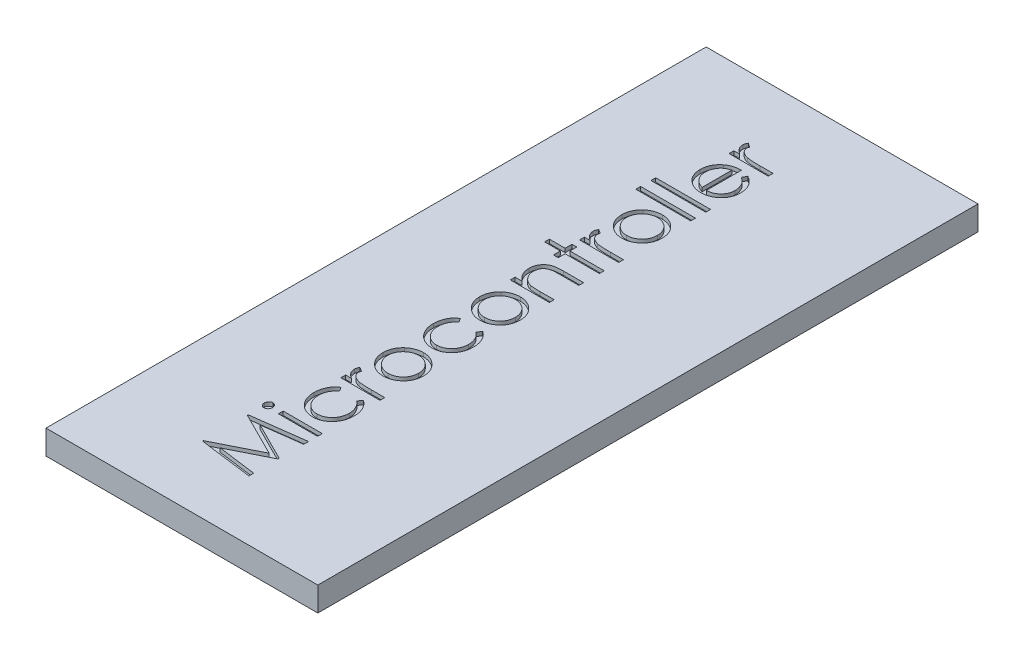
from build123d import *

# Parameters (mm, degrees)
SKETCH1_W           = 17.78
SKETCH1_H           = 43.18
BOSS_EXTRUDE1_DEPTH = 1.5875
SKETCH2_W           = 2.557692308
SKETCH2_H           = 0.314102564
SKETCH2_W_2         = 3.58974359
CUT_EXTRUDE1_DEPTH  = 0.254


with BuildPart() as part:
    # Sketch1 → Boss-Extrude1 (new body)
    with BuildSketch(Plane(origin=(0, 0, 0), x_dir=(1, 0, 0), z_dir=(0, 1, 0))):
        Rectangle(SKETCH1_W, SKETCH1_H)
    extrude(amount=BOSS_EXTRUDE1_DEPTH)

    # Sketch2 → Cut-Extrude1 (cut)
    # profile 1 of 16: a face of its own
    with BuildSketch(Plane(origin=(0, 1.5875, 0), x_dir=(1, 0, 0), z_dir=(0, 1, 0))):
        Polygon((0.45690123, -17.66715988), (-3.04309877, -17.205120617), (-3.04309877, -17.160248822), (-0.171303899, -15.715236803), (-3.04309877, -14.273730393), (-3.04309877, -14.228157476), (0.45690123, -13.763313726), (0.45690123, -14.078818534), (-2.061528258, -14.413954752), (0.45690123, -15.677376226), (0.45690123, -15.748189528), (-2.067137232, -17.016518854), (0.45690123, -17.350953951), align=None)
    # profile 2 of 16: a face of its own
    with BuildSketch(Plane(origin=(0, 1.5875, 0), x_dir=(1, 0, 0), z_dir=(0, 1, 0))):
        with BuildLine():
            add(Edge.make_bspline(
                [(-3.177714155, -13.024331354), (-3.176810003, -13.004840039), (-3.175039499, -12.966672299), (-3.159878022, -12.911479031), (-3.134178336, -12.861222019), (-3.099698655, -12.816644286), (-3.059149212, -12.778392399), (-3.011888243, -12.751611689), (-2.960829605, -12.734399293), (-2.925214515, -12.732320738), (-2.907081142, -12.731262444)],
                knots=[0, 0, 0, 0, 1.055194115, 2.066272739, 3.074728998, 4.095836921, 5.109056067, 6.073838105, 7.019297344, 8, 8, 8, 8], degree=3))
            add(Edge.make_bspline(
                [(-2.907081142, -12.731262444), (-2.889418489, -12.732344604), (-2.854501514, -12.734483906), (-2.804328042, -12.751598394), (-2.757723759, -12.778620632), (-2.717253048, -12.816619758), (-2.682792428, -12.861228519), (-2.657087689, -12.911477304), (-2.641927552, -12.966672753), (-2.640156863, -13.004840192), (-2.639252617, -13.024331354)],
                knots=[0, 0, 0, 0, 0.96129708, 1.900370562, 2.859976407, 3.87933698, 4.906634145, 5.921202961, 6.938410037, 8, 8, 8, 8], degree=3))
            add(Edge.make_bspline(
                [(-2.639252617, -13.024331354), (-2.640122337, -13.04359963), (-2.641815134, -13.08110281), (-2.657385151, -13.135469652), (-2.682801224, -13.185298142), (-2.71702741, -13.229962814), (-2.757972307, -13.267193007), (-2.804299601, -13.294291333), (-2.854508755, -13.311366295), (-2.889420922, -13.313510923), (-2.907081142, -13.314595778)],
                knots=[0, 0, 0, 0, 1.054934014, 2.053291228, 3.073705704, 4.106921865, 5.123545215, 6.088680038, 7.033164197, 8, 8, 8, 8], degree=3))
            add(Edge.make_bspline(
                [(-2.907081142, -13.314595778), (-2.925211992, -13.313534691), (-2.960822124, -13.31145065), (-3.011917157, -13.294278534), (-3.058898659, -13.267418726), (-3.099924159, -13.229938162), (-3.134169593, -13.185304702), (-3.159580575, -13.135467957), (-3.175151914, -13.081103258), (-3.176844529, -13.043599782), (-3.177714155, -13.024331354)],
                knots=[0, 0, 0, 0, 0.98631895, 1.937192651, 2.907499808, 3.917963147, 4.944918757, 5.95915025, 6.951458133, 8, 8, 8, 8], degree=3))
        make_face()
    # profile 3 of 16: a face of its own
    with BuildSketch(Plane(origin=(0, 1.5875, 0), x_dir=(1, 0, 0), z_dir=(0, 1, 0))):
        with Locations((-0.821944924, -13.022929111)):
            Rectangle(SKETCH2_W, SKETCH2_H)
    # profile 4 of 16: a face of its own
    with BuildSketch(Plane(origin=(0, 1.5875, 0), x_dir=(1, 0, 0), z_dir=(0, 1, 0))):
        with BuildLine():
            Line((-1.546203738, -9.635108598), (-1.38284236, -9.898029271))
            add(Edge.make_bspline(
                [(-1.38284236, -9.898029271), (-1.418670754, -9.926859136), (-1.489192864, -9.983605832), (-1.580202798, -10.082145068), (-1.658369839, -10.187156482), (-1.72207359, -10.30043453), (-1.771295041, -10.42182033), (-1.806125246, -10.550835181), (-1.827829489, -10.687460686), (-1.830296326, -10.781125885), (-1.831560309, -10.829119015)],
                knots=[0, 0, 0, 0, 1.026593902, 2.0206758, 2.988051866, 3.946915611, 4.916868779, 5.907761954, 6.927957743, 8, 8, 8, 8], degree=3))
            add(Edge.make_bspline(
                [(-1.831560309, -10.829119015), (-1.830503467, -10.867477972), (-1.828422045, -10.943024894), (-1.815411551, -11.053931048), (-1.791769543, -11.159573401), (-1.760618586, -11.26061411), (-1.718868296, -11.356334528), (-1.66805854, -11.446985447), (-1.6090085, -11.533370937), (-1.540597955, -11.612987678), (-1.466199287, -11.685816685), (-1.386445592, -11.748915599), (-1.3037257, -11.803852532), (-1.215973958, -11.846958489), (-1.125197905, -11.882233659), (-1.029684049, -11.905440379), (-0.930656042, -11.920905075), (-0.863137702, -11.922674403), (-0.828956142, -11.923570136)],
                knots=[0, 0, 0, 0, 1.112346261, 2.190735716, 3.231507886, 4.247384806, 5.251966152, 6.253067467, 7.256802811, 8.280671706, 9.291813951, 10.270744147, 11.225547591, 12.165006084, 13.100104208, 14.043489273, 15.009504848, 16, 16, 16, 16], degree=3))
            add(Edge.make_bspline(
                [(-0.828956142, -11.923570136), (-0.784193329, -11.921763918), (-0.695041781, -11.918166576), (-0.563666016, -11.890806002), (-0.436881641, -11.845024554), (-0.315374074, -11.78317594), (-0.2027897, -11.704669325), (-0.101803653, -11.612504577), (-0.014388318, -11.506583404), (0.058084398, -11.387851649), (0.116345713, -11.259093747), (0.15785306, -11.121703685), (0.182905429, -10.976803893), (0.186061373, -10.877597148), (0.18767046, -10.827015649)],
                knots=[0, 0, 0, 0, 0.96628757, 1.924499989, 2.884001032, 3.87047137, 4.860396324, 5.839257425, 6.814467993, 7.816059692, 8.834901047, 9.858382822, 10.908076205, 12, 12, 12, 12], degree=3))
            add(Edge.make_bspline(
                [(0.18767046, -10.827015649), (0.186370963, -10.780660465), (0.183817106, -10.689560227), (0.162288143, -10.556392941), (0.127044509, -10.429613031), (0.077896859, -10.309225), (0.014369343, -10.195448834), (-0.063989827, -10.089019659), (-0.154926428, -9.987819721), (-0.225244399, -9.928322744), (-0.261047488, -9.898029271)],
                knots=[0, 0, 0, 0, 1.039848629, 2.043578496, 3.018386758, 3.987534228, 4.954977003, 5.934852016, 6.948509513, 8, 8, 8, 8], degree=3))
            Line((-0.261047488, -9.898029271), (-0.088571527, -9.635108598))
            add(Edge.make_bspline(
                [(-0.088571527, -9.635108598), (-0.0656808, -9.6506963), (-0.019975323, -9.681819967), (0.044468793, -9.733847593), (0.104790476, -9.789967424), (0.160908866, -9.849960521), (0.214166885, -9.913043531), (0.26201846, -9.981371441), (0.307153282, -10.052741052), (0.347766154, -10.12799021), (0.384272476, -10.206340908), (0.415663647, -10.287682897), (0.442633753, -10.37166271), (0.464071099, -10.458379086), (0.481181938, -10.548002985), (0.492535639, -10.640302619), (0.501010921, -10.735246201), (0.501516787, -10.799418352), (0.501773024, -10.831923502)],
                knots=[0, 0, 0, 0, 0.954134338, 1.905101784, 2.851144739, 3.791306361, 4.734911809, 5.6936923, 6.663572882, 7.643865596, 8.638447847, 9.640600242, 10.646758161, 11.676244097, 12.717260333, 13.78922464, 14.880174919, 16, 16, 16, 16], degree=3))
            add(Edge.make_bspline(
                [(0.501773024, -10.831923502), (0.500880264, -10.881533737), (0.499130447, -10.978770157), (0.479942862, -11.121101821), (0.450909386, -11.257082238), (0.409591883, -11.386950373), (0.355027378, -11.509912262), (0.289902697, -11.626991567), (0.212065657, -11.736980107), (0.123365407, -11.839156833), (0.027095649, -11.932597415), (-0.076187344, -12.013905418), (-0.184201317, -12.08281141), (-0.297627109, -12.139573914), (-0.415999621, -12.183956896), (-0.540041999, -12.214512999), (-0.668701808, -12.234228834), (-0.756433652, -12.236514123), (-0.80091127, -12.237672701)],
                knots=[0, 0, 0, 0, 1.113096611, 2.181677437, 3.217994567, 4.231807234, 5.234933164, 6.233258928, 7.234764453, 8.254006763, 9.267004511, 10.242118657, 11.199842941, 12.138404996, 13.084707599, 14.031460992, 15.002005182, 16, 16, 16, 16], degree=3))
            add(Edge.make_bspline(
                [(-0.80091127, -12.237672701), (-0.831089705, -12.237231684), (-0.891119592, -12.236354431), (-0.980214659, -12.226292503), (-1.068123204, -12.21329403), (-1.153730924, -12.191268293), (-1.238336214, -12.165827661), (-1.320919315, -12.133352129), (-1.401863988, -12.095256734), (-1.480961717, -12.052004787), (-1.556911257, -12.003316042), (-1.628664922, -11.949434809), (-1.697084687, -11.892390473), (-1.759808448, -11.829514361), (-1.819344639, -11.763474707), (-1.874102763, -11.692403131), (-1.924243754, -11.616707279), (-1.97069477, -11.537523957), (-2.012054205, -11.454899245), (-2.047687443, -11.369332575), (-2.078140019, -11.281339546), (-2.102248938, -11.190779402), (-2.122466361, -11.098253229), (-2.135184208, -11.003031891), (-2.14417048, -10.905479668), (-2.145161273, -10.839423646), (-2.145662873, -10.805981995)],
                knots=[0, 0, 0, 0, 0.990994727, 1.971252077, 2.943264845, 3.907940874, 4.872158414, 5.844625996, 6.82015047, 7.809835459, 8.804511986, 9.781214284, 10.756496977, 11.728388426, 12.696359165, 13.676225489, 14.672885716, 15.677705647, 16.690706858, 17.706033469, 18.721040654, 19.747369689, 20.783475414, 21.830280724, 22.901553713, 24, 24, 24, 24], degree=3))
            add(Edge.make_bspline(
                [(-2.145662873, -10.805981995), (-2.144741077, -10.764101835), (-2.142902094, -10.680550852), (-2.127422024, -10.556610918), (-2.104090939, -10.434492817), (-2.069498322, -10.316356505), (-2.027705785, -10.203571202), (-1.980492031, -10.098275654), (-1.92682662, -10.002060032), (-1.867038109, -9.914075662), (-1.798929452, -9.834346921), (-1.723193909, -9.760830339), (-1.639286333, -9.693041543), (-1.577487338, -9.654578952), (-1.546203738, -9.635108598)],
                knots=[0, 0, 0, 0, 1.095139042, 2.184804066, 3.262657822, 4.34424993, 5.400369085, 6.407210964, 7.359649996, 8.278719237, 9.185177137, 10.097389079, 11.036869154, 12, 12, 12, 12], degree=3))
        make_face()
    # profile 5 of 16: a face of its own
    with BuildSketch(Plane(origin=(0, 1.5875, 0), x_dir=(1, 0, 0), z_dir=(0, 1, 0))):
        with BuildLine():
            Line((-2.100791078, -9.09664706), (-2.100791078, -8.782544495))
            Line((-2.100791078, -8.782544495), (-1.724288674, -8.782544495))
            add(Edge.make_bspline(
                [(-1.724288674, -8.782544495), (-1.759360196, -8.759370574), (-1.82643421, -8.715050629), (-1.915024828, -8.641040811), (-1.989211982, -8.566041237), (-2.047580911, -8.488082556), (-2.091693568, -8.40792909), (-2.122690151, -8.326256734), (-2.141912074, -8.242865767), (-2.144410932, -8.186690305), (-2.145662873, -8.158546098)],
                knots=[0, 0, 0, 0, 1.280091057, 2.448164201, 3.510831157, 4.48793739, 5.405868014, 6.289422536, 7.142991551, 8, 8, 8, 8], degree=3))
            add(Edge.make_bspline(
                [(-2.145662873, -8.158546098), (-2.144472346, -8.136719772), (-2.142022761, -8.091810686), (-2.124811936, -8.023828097), (-2.097333913, -7.953784645), (-2.071493691, -7.908642257), (-2.058022649, -7.885108598)],
                knots=[0, 0, 0, 0, 0.901110191, 1.854092781, 2.881294221, 4, 4, 4, 4], degree=3))
            Line((-2.058022649, -7.885108598), (-1.785987392, -8.05758456))
            add(Edge.make_bspline(
                [(-1.785987392, -8.05758456), (-1.792727658, -8.072693581), (-1.805521974, -8.101373395), (-1.820663984, -8.143327962), (-1.8295799, -8.182009298), (-1.830930617, -8.206652857), (-1.831560309, -8.218141451)],
                knots=[0, 0, 0, 0, 1.180555205, 2.24091978, 3.179933427, 4, 4, 4, 4], degree=3))
            add(Edge.make_bspline(
                [(-1.831560309, -8.218141451), (-1.829893428, -8.243354752), (-1.826493475, -8.294782577), (-1.79938281, -8.370033911), (-1.756839991, -8.443709286), (-1.708396299, -8.50165752), (-1.661861896, -8.546684384), (-1.621134031, -8.579066563), (-1.575043227, -8.60813005), (-1.525370995, -8.636322404), (-1.470870703, -8.66251523), (-1.411453441, -8.685922367), (-1.347609855, -8.707812547), (-1.303217921, -8.720140087), (-1.280478578, -8.726454752)],
                knots=[0, 0, 0, 0, 1.125322384, 2.295331465, 3.535939348, 4.916963136, 5.656144286, 6.429838446, 7.238666481, 8.090384391, 8.983239461, 9.940052224, 10.944811494, 12, 12, 12, 12], degree=3))
            add(Edge.make_bspline(
                [(-1.280478578, -8.726454752), (-1.260202527, -8.731195324), (-1.215067404, -8.741747985), (-1.139690004, -8.751734378), (-1.050691377, -8.761998762), (-0.947968133, -8.769008302), (-0.831125402, -8.775629748), (-0.700667242, -8.779287708), (-0.556235089, -8.782428112), (-0.455494229, -8.782504463), (-0.402674091, -8.782544495)],
                knots=[0, 0, 0, 0, 0.566841273, 1.261806378, 2.068780918, 3.007109044, 4.065315289, 5.256255371, 6.561408263, 8, 8, 8, 8], degree=3))
            Line((-0.402674091, -8.782544495), (0.45690123, -8.782544495))
            Line((0.45690123, -8.782544495), (0.45690123, -9.09664706))
            Line((0.45690123, -9.09664706), (-2.100791078, -9.09664706))
        make_face()
    # profile 6 of 16: a face of its own
    with BuildSketch(Plane(origin=(0, 1.5875, 0), x_dir=(1, 0, 0), z_dir=(0, 1, 0))):
        with BuildLine():
            add(Edge.make_bspline(
                [(-2.145662873, -6.290757636), (-2.144640982, -6.242766364), (-2.142637303, -6.148667206), (-2.121222337, -6.01085932), (-2.088474973, -5.879314184), (-2.043203411, -5.753527992), (-1.98252146, -5.635111697), (-1.910112169, -5.522340453), (-1.824329576, -5.415523444), (-1.757971507, -5.351500414), (-1.724288674, -5.319002829)],
                knots=[0, 0, 0, 0, 1.054011418, 2.066658804, 3.057071809, 4.030435133, 4.997543892, 5.974964718, 6.972108034, 8, 8, 8, 8], degree=3))
            add(Edge.make_bspline(
                [(-1.724288674, -5.319002829), (-1.692074689, -5.291020875), (-1.628270146, -5.235598494), (-1.524814533, -5.164532776), (-1.417674433, -5.103311216), (-1.305427106, -5.054248255), (-1.189052435, -5.015563231), (-1.068150424, -4.988097535), (-0.942988077, -4.9717606), (-0.857984239, -4.969557633), (-0.814933706, -4.968441931)],
                knots=[0, 0, 0, 0, 1.025258237, 2.030674902, 3.01204498, 3.988269485, 4.97094183, 5.956517959, 6.965070386, 8, 8, 8, 8], degree=3))
            add(Edge.make_bspline(
                [(-0.814933706, -4.968441931), (-0.771633649, -4.969423269), (-0.686070715, -4.971362437), (-0.56005135, -4.989706053), (-0.437856527, -5.018237139), (-0.319997833, -5.059068977), (-0.206115006, -5.111427087), (-0.096705456, -5.175317774), (0.008446677, -5.251189391), (0.108448515, -5.337193388), (0.20061473, -5.432245264), (0.280942999, -5.535361413), (0.349764524, -5.644515446), (0.405200939, -5.7611588), (0.44891064, -5.884226286), (0.479610656, -6.013983355), (0.49817234, -6.150228425), (0.500555913, -6.243255646), (0.501773024, -6.290757636)],
                knots=[0, 0, 0, 0, 0.998656419, 1.973391657, 2.932242238, 3.890759089, 4.846373663, 5.82037756, 6.809684879, 7.83454468, 8.860553229, 9.859544525, 10.845671541, 11.83227036, 12.833544569, 13.85385346, 14.904124723, 16, 16, 16, 16], degree=3))
            add(Edge.make_bspline(
                [(0.501773024, -6.290757636), (0.500551828, -6.338492356), (0.498160054, -6.431983216), (0.479682771, -6.568709198), (0.448924788, -6.698698817), (0.405057296, -6.821927415), (0.349762752, -6.939072262), (0.281151062, -7.048858759), (0.200590907, -7.152058675), (0.10845497, -7.247130659), (0.008445014, -7.333129264), (-0.096705025, -7.409002273), (-0.206115118, -7.472892599), (-0.319997803, -7.525250803), (-0.437856535, -7.566082616), (-0.560051347, -7.594613708), (-0.686070716, -7.612957323), (-0.771633649, -7.614896491), (-0.814933706, -7.615877829)],
                knots=[0, 0, 0, 0, 1.099876186, 2.154163076, 3.173186993, 4.173200201, 5.163417411, 6.152872554, 7.150605724, 8.17532212, 9.198891216, 10.186952605, 11.159729845, 12.11414092, 13.071450619, 14.029093627, 15.002601286, 16, 16, 16, 16], degree=3))
            add(Edge.make_bspline(
                [(-0.814933706, -7.615877829), (-0.857751208, -7.614757187), (-0.942522501, -7.612538509), (-1.067435701, -7.59617928), (-1.187967682, -7.569012431), (-1.303706854, -7.529791122), (-1.415684397, -7.480819238), (-1.523217331, -7.420213846), (-1.626220886, -7.348460685), (-1.689940816, -7.29325362), (-1.722185309, -7.265316931)],
                knots=[0, 0, 0, 0, 1.031377469, 2.041950136, 3.029500481, 4.003457997, 4.981637986, 5.969878303, 6.97268806, 8, 8, 8, 8], degree=3))
            add(Edge.make_bspline(
                [(-1.722185309, -7.265316931), (-1.756160248, -7.23286834), (-1.822977944, -7.169052476), (-1.908510468, -7.061703749), (-1.982426542, -6.949209928), (-2.041902758, -6.829485002), (-2.088741275, -6.703802144), (-2.121306791, -6.571582901), (-2.142560146, -6.433307386), (-2.144618323, -6.338747764), (-2.145662873, -6.290757636)],
                knots=[0, 0, 0, 0, 1.027980169, 2.021703884, 2.998553061, 3.971491411, 4.943284454, 5.930300938, 6.949603206, 8, 8, 8, 8], degree=3))
        make_face()
        with BuildLine():
            add(Edge.make_bspline(
                [(-1.831560309, -6.29215988), (-1.830595717, -6.326097491), (-1.828691435, -6.39309662), (-1.81420753, -6.491716204), (-1.791260027, -6.586656362), (-1.758655965, -6.678097192), (-1.71655709, -6.765730417), (-1.664848639, -6.849639619), (-1.604216033, -6.930072834), (-1.534752001, -7.005451895), (-1.458878057, -7.074645348), (-1.378011455, -7.135083085), (-1.293390902, -7.18676386), (-1.20488906, -7.229035665), (-1.112204172, -7.261455138), (-1.01588206, -7.284428192), (-0.915631866, -7.298938619), (-0.847468755, -7.300819472), (-0.812830341, -7.301775265)],
                knots=[0, 0, 0, 0, 1.02155314, 2.01673505, 2.994700672, 3.958461264, 4.934171024, 5.916582427, 6.921469794, 7.962398674, 8.998583302, 10.009097305, 10.997513862, 11.97957236, 12.956600784, 13.948243505, 14.957359924, 16, 16, 16, 16], degree=3))
            add(Edge.make_bspline(
                [(-0.812830341, -7.301775265), (-0.768078314, -7.300168441), (-0.679253908, -7.296979197), (-0.548442786, -7.27104396), (-0.422860934, -7.22765768), (-0.303244547, -7.169070401), (-0.192572269, -7.095664182), (-0.093900785, -7.009177115), (-0.008714974, -6.910537415), (0.061965872, -6.800920915), (0.118125628, -6.682566597), (0.157924603, -6.557310276), (0.183796296, -6.426669582), (0.18636777, -6.33738885), (0.18767046, -6.29215988)],
                knots=[0, 0, 0, 0, 1.016792936, 2.018143844, 3.017858371, 4.030088057, 5.03801393, 6.028138512, 7.003788237, 7.991172063, 8.984598303, 9.972568034, 10.972917682, 12, 12, 12, 12], degree=3))
            add(Edge.make_bspline(
                [(0.18767046, -6.29215988), (0.18636018, -6.246933511), (0.183773723, -6.157657915), (0.158054903, -6.027198738), (0.117951243, -5.902284766), (0.062029033, -5.784053379), (-0.008983382, -5.674486776), (-0.093419759, -5.575137654), (-0.19283361, -5.489389043), (-0.303391139, -5.416055438), (-0.422675491, -5.356508695), (-0.548465964, -5.313325494), (-0.679248005, -5.287327908), (-0.768076336, -5.284147079), (-0.812830341, -5.282544495)],
                knots=[0, 0, 0, 0, 1.02726834, 2.027799167, 3.010890988, 4.004497153, 4.992059811, 5.971914811, 6.958719428, 7.966827853, 8.981595046, 9.981490638, 10.983022906, 12, 12, 12, 12], degree=3))
            add(Edge.make_bspline(
                [(-0.812830341, -5.282544495), (-0.847468962, -5.283499958), (-0.91563248, -5.285380163), (-1.015879713, -5.299895308), (-1.112212758, -5.322850937), (-1.204857442, -5.355334491), (-1.29362052, -5.397418528), (-1.377763406, -5.450092805), (-1.459158119, -5.510283689), (-1.534506719, -5.580311948), (-1.60424311, -5.655612334), (-1.664872151, -5.736078143), (-1.716329836, -5.819862922), (-1.759016053, -5.907241557), (-1.7909634, -5.998694111), (-1.81434003, -6.093501244), (-1.828630227, -6.191700053), (-1.830577368, -6.258459096), (-1.831560309, -6.29215988)],
                knots=[0, 0, 0, 0, 1.042975879, 2.052417305, 3.044379404, 4.0217225, 5.00409729, 5.996508862, 7.007348322, 8.048612455, 9.089876587, 10.095087598, 11.077815406, 12.047498138, 13.018202342, 13.98964644, 14.985148868, 16, 16, 16, 16], degree=3))
        make_face(mode=Mode.SUBTRACT)
    # profile 7 of 16: a face of its own
    with BuildSketch(Plane(origin=(0, 1.5875, 0), x_dir=(1, 0, 0), z_dir=(0, 1, 0))):
        with BuildLine():
            Line((-1.546203738, -1.82741629), (-1.38284236, -2.090336963))
            add(Edge.make_bspline(
                [(-1.38284236, -2.090336963), (-1.418670754, -2.119166829), (-1.489192864, -2.175913524), (-1.580202798, -2.27445276), (-1.658369839, -2.379464175), (-1.72207359, -2.492742222), (-1.771295041, -2.614128022), (-1.806125246, -2.743142874), (-1.827829489, -2.879768379), (-1.830296326, -2.973433578), (-1.831560309, -3.021426707)],
                knots=[0, 0, 0, 0, 1.026593902, 2.0206758, 2.988051866, 3.946915611, 4.916868779, 5.907761954, 6.927957743, 8, 8, 8, 8], degree=3))
            add(Edge.make_bspline(
                [(-1.831560309, -3.021426707), (-1.830503467, -3.059785664), (-1.828422045, -3.135332587), (-1.815411551, -3.24623874), (-1.791769543, -3.351881093), (-1.760618586, -3.452921802), (-1.718868296, -3.548642221), (-1.66805854, -3.639293139), (-1.6090085, -3.725678629), (-1.540597955, -3.80529537), (-1.466199287, -3.878124377), (-1.386445592, -3.941223291), (-1.3037257, -3.996160225), (-1.215973958, -4.039266181), (-1.125197905, -4.074541351), (-1.029684049, -4.097748072), (-0.930656042, -4.113212767), (-0.863137702, -4.114982096), (-0.828956142, -4.115877829)],
                knots=[0, 0, 0, 0, 1.112346261, 2.190735716, 3.231507886, 4.247384806, 5.251966152, 6.253067467, 7.256802811, 8.280671706, 9.291813951, 10.270744147, 11.225547591, 12.165006084, 13.100104208, 14.043489273, 15.009504848, 16, 16, 16, 16], degree=3))
            add(Edge.make_bspline(
                [(-0.828956142, -4.115877829), (-0.784193329, -4.114071611), (-0.695041781, -4.110474268), (-0.563666016, -4.083113694), (-0.436881641, -4.037332246), (-0.315374074, -3.975483633), (-0.2027897, -3.896977018), (-0.101803653, -3.804812269), (-0.014388318, -3.698891096), (0.058084398, -3.580159341), (0.116345713, -3.451401439), (0.15785306, -3.314011378), (0.182905429, -3.169111586), (0.186061373, -3.06990484), (0.18767046, -3.019323342)],
                knots=[0, 0, 0, 0, 0.96628757, 1.924499989, 2.884001032, 3.87047137, 4.860396324, 5.839257425, 6.814467993, 7.816059692, 8.834901047, 9.858382822, 10.908076205, 12, 12, 12, 12], degree=3))
            add(Edge.make_bspline(
                [(0.18767046, -3.019323342), (0.186370963, -2.972968157), (0.183817106, -2.881867919), (0.162288143, -2.748700634), (0.127044509, -2.621920723), (0.077896859, -2.501532692), (0.014369343, -2.387756526), (-0.063989827, -2.281327351), (-0.154926428, -2.180127413), (-0.225244399, -2.120630436), (-0.261047488, -2.090336963)],
                knots=[0, 0, 0, 0, 1.039848629, 2.043578496, 3.018386758, 3.987534228, 4.954977003, 5.934852016, 6.948509513, 8, 8, 8, 8], degree=3))
            Line((-0.261047488, -2.090336963), (-0.088571527, -1.82741629))
            add(Edge.make_bspline(
                [(-0.088571527, -1.82741629), (-0.0656808, -1.843003993), (-0.019975323, -1.874127659), (0.044468793, -1.926155285), (0.104790476, -1.982275117), (0.160908866, -2.042268213), (0.214166885, -2.105351223), (0.26201846, -2.173679133), (0.307153282, -2.245048744), (0.347766154, -2.320297902), (0.384272476, -2.3986486), (0.415663647, -2.47999059), (0.442633753, -2.563970402), (0.464071099, -2.650686779), (0.481181938, -2.740310677), (0.492535639, -2.832610311), (0.501010921, -2.927553893), (0.501516787, -2.991726044), (0.501773024, -3.024231194)],
                knots=[0, 0, 0, 0, 0.954134338, 1.905101784, 2.851144739, 3.791306361, 4.734911809, 5.6936923, 6.663572882, 7.643865596, 8.638447847, 9.640600242, 10.646758161, 11.676244097, 12.717260333, 13.78922464, 14.880174919, 16, 16, 16, 16], degree=3))
            add(Edge.make_bspline(
                [(0.501773024, -3.024231194), (0.500880264, -3.073841429), (0.499130447, -3.171077849), (0.479942862, -3.313409513), (0.450909386, -3.44938993), (0.409591883, -3.579258065), (0.355027378, -3.702219955), (0.289902697, -3.819299259), (0.212065657, -3.9292878), (0.123365407, -4.031464526), (0.027095649, -4.124905108), (-0.076187344, -4.20621311), (-0.184201317, -4.275119102), (-0.297627109, -4.331881606), (-0.415999621, -4.376264588), (-0.540041999, -4.406820691), (-0.668701808, -4.426536526), (-0.756433652, -4.428821815), (-0.80091127, -4.429980393)],
                knots=[0, 0, 0, 0, 1.113096611, 2.181677437, 3.217994567, 4.231807234, 5.234933164, 6.233258928, 7.234764453, 8.254006763, 9.267004511, 10.242118657, 11.199842941, 12.138404996, 13.084707599, 14.031460992, 15.002005182, 16, 16, 16, 16], degree=3))
            add(Edge.make_bspline(
                [(-0.80091127, -4.429980393), (-0.831089705, -4.429539377), (-0.891119592, -4.428662123), (-0.980214659, -4.418600195), (-1.068123204, -4.405601722), (-1.153730924, -4.383575985), (-1.238336214, -4.358135353), (-1.320919315, -4.325659822), (-1.401863988, -4.287564427), (-1.480961717, -4.244312479), (-1.556911257, -4.195623734), (-1.628664922, -4.141742501), (-1.697084687, -4.084698165), (-1.759808448, -4.021822053), (-1.819344639, -3.955782399), (-1.874102763, -3.884710823), (-1.924243754, -3.809014972), (-1.97069477, -3.729831649), (-2.012054205, -3.647206938), (-2.047687443, -3.561640267), (-2.078140019, -3.473647238), (-2.102248938, -3.383087094), (-2.122466361, -3.290560921), (-2.135184208, -3.195339583), (-2.14417048, -3.097787361), (-2.145161273, -3.031731338), (-2.145662873, -2.998289688)],
                knots=[0, 0, 0, 0, 0.990994727, 1.971252077, 2.943264845, 3.907940874, 4.872158414, 5.844625996, 6.82015047, 7.809835459, 8.804511986, 9.781214284, 10.756496977, 11.728388426, 12.696359165, 13.676225489, 14.672885716, 15.677705647, 16.690706858, 17.706033469, 18.721040654, 19.747369689, 20.783475414, 21.830280724, 22.901553713, 24, 24, 24, 24], degree=3))
            add(Edge.make_bspline(
                [(-2.145662873, -2.998289688), (-2.144741077, -2.956409528), (-2.142902094, -2.872858544), (-2.127422024, -2.748918611), (-2.104090939, -2.626800509), (-2.069498322, -2.508664197), (-2.027705785, -2.395878895), (-1.980492031, -2.290583346), (-1.92682662, -2.194367724), (-1.867038109, -2.106383354), (-1.798929452, -2.026654614), (-1.723193909, -1.953138032), (-1.639286333, -1.885349235), (-1.577487338, -1.846886644), (-1.546203738, -1.82741629)],
                knots=[0, 0, 0, 0, 1.095139042, 2.184804066, 3.262657822, 4.34424993, 5.400369085, 6.407210964, 7.359649996, 8.278719237, 9.185177137, 10.097389079, 11.036869154, 12, 12, 12, 12], degree=3))
        make_face()
    # profile 8 of 16: a face of its own
    with BuildSketch(Plane(origin=(0, 1.5875, 0), x_dir=(1, 0, 0), z_dir=(0, 1, 0))):
        with BuildLine():
            add(Edge.make_bspline(
                [(-2.145662873, 0.03616544), (-2.144640982, 0.084156713), (-2.142637303, 0.178255871), (-2.121222337, 0.316063757), (-2.088474973, 0.447608893), (-2.043203411, 0.573395085), (-1.98252146, 0.69181138), (-1.910112169, 0.804582624), (-1.824329576, 0.911399633), (-1.757971507, 0.975422663), (-1.724288674, 1.007920248)],
                knots=[0, 0, 0, 0, 1.054011418, 2.066658804, 3.057071809, 4.030435133, 4.997543892, 5.974964718, 6.972108034, 8, 8, 8, 8], degree=3))
            add(Edge.make_bspline(
                [(-1.724288674, 1.007920248), (-1.692074689, 1.035902202), (-1.628270146, 1.091324582), (-1.524814533, 1.162390301), (-1.417674433, 1.223611861), (-1.305427106, 1.272674822), (-1.189052435, 1.311359846), (-1.068150424, 1.338825542), (-0.942988077, 1.355162477), (-0.857984239, 1.357365444), (-0.814933706, 1.358481146)],
                knots=[0, 0, 0, 0, 1.025258237, 2.030674902, 3.01204498, 3.988269485, 4.97094183, 5.956517959, 6.965070386, 8, 8, 8, 8], degree=3))
            add(Edge.make_bspline(
                [(-0.814933706, 1.358481146), (-0.771633649, 1.357499808), (-0.686070715, 1.35556064), (-0.56005135, 1.337217024), (-0.437856527, 1.308685938), (-0.319997833, 1.267854099), (-0.206115006, 1.21549599), (-0.096705456, 1.151605303), (0.008446677, 1.075733686), (0.108448515, 0.989729689), (0.20061473, 0.894677813), (0.280942999, 0.791561664), (0.349764524, 0.682407631), (0.405200939, 0.565764277), (0.44891064, 0.44269679), (0.479610656, 0.312939722), (0.49817234, 0.176694652), (0.500555913, 0.083667431), (0.501773024, 0.03616544)],
                knots=[0, 0, 0, 0, 0.998656419, 1.973391657, 2.932242238, 3.890759089, 4.846373663, 5.82037756, 6.809684879, 7.83454468, 8.860553229, 9.859544525, 10.845671541, 11.83227036, 12.833544569, 13.85385346, 14.904124723, 16, 16, 16, 16], degree=3))
            add(Edge.make_bspline(
                [(0.501773024, 0.03616544), (0.500551828, -0.011569279), (0.498160054, -0.105060139), (0.479682771, -0.241786121), (0.448924788, -0.37177574), (0.405057296, -0.495004338), (0.349762752, -0.612149185), (0.281151062, -0.721935682), (0.200590907, -0.825135598), (0.10845497, -0.920207582), (0.008445014, -1.006206187), (-0.096705025, -1.082079196), (-0.206115118, -1.145969522), (-0.319997803, -1.198327726), (-0.437856535, -1.239159539), (-0.560051347, -1.267690631), (-0.686070716, -1.286034246), (-0.771633649, -1.287973414), (-0.814933706, -1.288954752)],
                knots=[0, 0, 0, 0, 1.099876186, 2.154163076, 3.173186993, 4.173200201, 5.163417411, 6.152872554, 7.150605724, 8.17532212, 9.198891216, 10.186952605, 11.159729845, 12.11414092, 13.071450619, 14.029093627, 15.002601286, 16, 16, 16, 16], degree=3))
            add(Edge.make_bspline(
                [(-0.814933706, -1.288954752), (-0.857751208, -1.28783411), (-0.942522501, -1.285615432), (-1.067435701, -1.269256203), (-1.187967682, -1.242089354), (-1.303706854, -1.202868045), (-1.415684397, -1.153896161), (-1.523217331, -1.093290769), (-1.626220886, -1.021537608), (-1.689940816, -0.966330543), (-1.722185309, -0.938393854)],
                knots=[0, 0, 0, 0, 1.031377469, 2.041950136, 3.029500481, 4.003457997, 4.981637986, 5.969878303, 6.97268806, 8, 8, 8, 8], degree=3))
            add(Edge.make_bspline(
                [(-1.722185309, -0.938393854), (-1.756160248, -0.905945263), (-1.822977944, -0.8421294), (-1.908510468, -0.734780672), (-1.982426542, -0.622286851), (-2.041902758, -0.502561925), (-2.088741275, -0.376879067), (-2.121306791, -0.244659824), (-2.142560146, -0.106384309), (-2.144618323, -0.011824688), (-2.145662873, 0.03616544)],
                knots=[0, 0, 0, 0, 1.027980169, 2.021703884, 2.998553061, 3.971491411, 4.943284454, 5.930300938, 6.949603206, 8, 8, 8, 8], degree=3))
        make_face()
        with BuildLine():
            add(Edge.make_bspline(
                [(-1.831560309, 0.034763197), (-1.830595717, 0.000825585), (-1.828691435, -0.066173543), (-1.81420753, -0.164793127), (-1.791260027, -0.259733285), (-1.758655965, -0.351174115), (-1.71655709, -0.43880734), (-1.664848639, -0.522716542), (-1.604216033, -0.603149757), (-1.534752001, -0.678528818), (-1.458878057, -0.747722271), (-1.378011455, -0.808160009), (-1.293390902, -0.859840783), (-1.20488906, -0.902112588), (-1.112204172, -0.934532061), (-1.01588206, -0.957505115), (-0.915631866, -0.972015542), (-0.847468755, -0.973896395), (-0.812830341, -0.974852188)],
                knots=[0, 0, 0, 0, 1.02155314, 2.01673505, 2.994700672, 3.958461264, 4.934171024, 5.916582427, 6.921469794, 7.962398674, 8.998583302, 10.009097305, 10.997513862, 11.97957236, 12.956600784, 13.948243505, 14.957359924, 16, 16, 16, 16], degree=3))
            add(Edge.make_bspline(
                [(-0.812830341, -0.974852188), (-0.768078314, -0.973245364), (-0.679253908, -0.97005612), (-0.548442786, -0.944120883), (-0.422860934, -0.900734603), (-0.303244547, -0.842147324), (-0.192572269, -0.768741105), (-0.093900785, -0.682254038), (-0.008714974, -0.583614338), (0.061965872, -0.473997838), (0.118125628, -0.35564352), (0.157924603, -0.230387199), (0.183796296, -0.099746505), (0.18636777, -0.010465774), (0.18767046, 0.034763197)],
                knots=[0, 0, 0, 0, 1.016792936, 2.018143844, 3.017858371, 4.030088057, 5.03801393, 6.028138512, 7.003788237, 7.991172063, 8.984598303, 9.972568034, 10.972917682, 12, 12, 12, 12], degree=3))
            add(Edge.make_bspline(
                [(0.18767046, 0.034763197), (0.18636018, 0.079989566), (0.183773723, 0.169265162), (0.158054903, 0.299724339), (0.117951243, 0.42463831), (0.062029033, 0.542869698), (-0.008983382, 0.652436301), (-0.093419759, 0.751785423), (-0.19283361, 0.837534034), (-0.303391139, 0.910867639), (-0.422675491, 0.970414381), (-0.548465964, 1.013597583), (-0.679248005, 1.039595169), (-0.768076336, 1.042775998), (-0.812830341, 1.044378581)],
                knots=[0, 0, 0, 0, 1.02726834, 2.027799167, 3.010890988, 4.004497153, 4.992059811, 5.971914811, 6.958719428, 7.966827853, 8.981595046, 9.981490638, 10.983022906, 12, 12, 12, 12], degree=3))
            add(Edge.make_bspline(
                [(-0.812830341, 1.044378581), (-0.847468962, 1.043423119), (-0.91563248, 1.041542914), (-1.015879713, 1.027027769), (-1.112212758, 1.00407214), (-1.204857442, 0.971588586), (-1.29362052, 0.929504549), (-1.377763406, 0.876830272), (-1.459158119, 0.816639388), (-1.534506719, 0.746611129), (-1.60424311, 0.671310743), (-1.664872151, 0.590844934), (-1.716329836, 0.507060154), (-1.759016053, 0.419681519), (-1.7909634, 0.328228966), (-1.81434003, 0.233421833), (-1.828630227, 0.135223024), (-1.830577368, 0.068463981), (-1.831560309, 0.034763197)],
                knots=[0, 0, 0, 0, 1.042975879, 2.052417305, 3.044379404, 4.0217225, 5.00409729, 5.996508862, 7.007348322, 8.048612455, 9.089876587, 10.095087598, 11.077815406, 12.047498138, 13.018202342, 13.98964644, 14.985148868, 16, 16, 16, 16], degree=3))
        make_face(mode=Mode.SUBTRACT)
    # profile 9 of 16: a face of its own
    with BuildSketch(Plane(origin=(0, 1.5875, 0), x_dir=(1, 0, 0), z_dir=(0, 1, 0))):
        with BuildLine():
            Line((-2.100791078, 1.986686274), (-2.100791078, 2.300788838))
            Line((-2.100791078, 2.300788838), (-1.639452937, 2.300788838))
            add(Edge.make_bspline(
                [(-1.639452937, 2.300788838), (-1.681358225, 2.334268579), (-1.762549174, 2.399135142), (-1.868421367, 2.508271779), (-1.957265072, 2.62206882), (-2.027216716, 2.742374509), (-2.080121319, 2.867950876), (-2.118271772, 2.998441598), (-2.141160757, 3.13455296), (-2.14415042, 3.227117853), (-2.145662873, 3.273945889)],
                knots=[0, 0, 0, 0, 1.127869841, 2.185233117, 3.191641716, 4.159226741, 5.10472073, 6.052603964, 7.014823782, 8, 8, 8, 8], degree=3))
            add(Edge.make_bspline(
                [(-2.145662873, 3.273945889), (-2.144018879, 3.3213004), (-2.140799573, 3.414031059), (-2.112351389, 3.548538682), (-2.067594573, 3.674933399), (-2.004044792, 3.791352173), (-1.925563112, 3.89654614), (-1.833993302, 3.988601441), (-1.729219019, 4.065362918), (-1.631447546, 4.116671103), (-1.544563503, 4.149826838), (-1.470255075, 4.171620341), (-1.387431132, 4.189250334), (-1.29629856, 4.205047963), (-1.196490681, 4.2155866), (-1.088245904, 4.223940468), (-0.971582914, 4.229915747), (-0.890896409, 4.230153444), (-0.849288674, 4.230276017)],
                knots=[0, 0, 0, 0, 1.235846195, 2.420061613, 3.574938557, 4.72781258, 5.870749808, 6.993217613, 8.10690044, 9.251157787, 9.865716151, 10.534141144, 11.271861846, 12.076851687, 12.949307443, 13.892392281, 14.913166647, 16, 16, 16, 16], degree=3))
            Line((-0.849288674, 4.230276017), (0.45690123, 4.230276017))
            Line((0.45690123, 4.230276017), (0.45690123, 3.916173453))
            Line((0.45690123, 3.916173453), (-0.74622377, 3.916173453))
            add(Edge.make_bspline(
                [(-0.74622377, 3.916173453), (-0.781046265, 3.915981045), (-0.847655772, 3.915613), (-0.943024146, 3.914436977), (-1.029279595, 3.911668675), (-1.10667001, 3.907618767), (-1.174912136, 3.901949919), (-1.234351402, 3.895881313), (-1.284461307, 3.888520989), (-1.314626351, 3.881957577), (-1.32815486, 3.879013998)],
                knots=[0, 0, 0, 0, 1.430803381, 2.736883362, 3.918614142, 4.976458302, 5.92063272, 6.731858525, 7.431260095, 8, 8, 8, 8], degree=3))
            add(Edge.make_bspline(
                [(-1.32815486, 3.879013998), (-1.367894574, 3.86844121), (-1.44417781, 3.848145983), (-1.54747316, 3.796975967), (-1.636129468, 3.733858299), (-1.708323401, 3.655656955), (-1.764524521, 3.564472231), (-1.803489908, 3.46015254), (-1.827868662, 3.343777538), (-1.830295433, 3.261922627), (-1.831560309, 3.219258389)],
                knots=[0, 0, 0, 0, 1.084232, 2.08126119, 3.027460722, 3.945137793, 4.874029258, 5.839697328, 6.874011781, 8, 8, 8, 8], degree=3))
            add(Edge.make_bspline(
                [(-1.831560309, 3.219258389), (-1.831091152, 3.19398846), (-1.830162701, 3.143979922), (-1.820611561, 3.069862697), (-1.805512822, 2.997748481), (-1.783261529, 2.927801447), (-1.755950038, 2.859794583), (-1.723093372, 2.793250561), (-1.682645841, 2.729705021), (-1.637427522, 2.668112291), (-1.58735576, 2.610796616), (-1.534509323, 2.55746902), (-1.478234223, 2.509930805), (-1.419434143, 2.466862181), (-1.35730234, 2.429683904), (-1.292438024, 2.39723082), (-1.224755878, 2.369695124), (-1.177780816, 2.356012432), (-1.154276655, 2.349166242)],
                knots=[0, 0, 0, 0, 1.023827899, 2.026128959, 3.023898047, 4.006668367, 4.997079741, 5.992687789, 7.009920206, 8.046337072, 9.087246971, 10.092051999, 11.086713115, 12.070168086, 13.043348831, 14.017773728, 15.008185103, 16, 16, 16, 16], degree=3))
            add(Edge.make_bspline(
                [(-1.154276655, 2.349166242), (-1.137021452, 2.345226593), (-1.099457778, 2.336650184), (-1.037813358, 2.327387004), (-0.966503383, 2.318979429), (-0.885611066, 2.31194247), (-0.794853191, 2.307637054), (-0.694617353, 2.302942657), (-0.584503865, 2.301233596), (-0.507842172, 2.300941242), (-0.467878418, 2.300788838)],
                knots=[0, 0, 0, 0, 0.615963638, 1.340920617, 2.168419149, 3.115676021, 4.16674242, 5.331190069, 6.6087489, 8, 8, 8, 8], degree=3))
            Line((-0.467878418, 2.300788838), (0.45690123, 2.300788838))
            Line((0.45690123, 2.300788838), (0.45690123, 1.986686274))
            Line((0.45690123, 1.986686274), (-2.100791078, 1.986686274))
        make_face()
    # profile 10 of 16: a face of its own
    with BuildSketch(Plane(origin=(0, 1.5875, 0), x_dir=(1, 0, 0), z_dir=(0, 1, 0))):
        Polygon((-3.13284236, 5.262327299), (-3.13284236, 5.576429864), (-2.100791078, 5.576429864), (-2.100791078, 6.025147812), (-1.786688514, 6.025147812), (-1.786688514, 5.576429864), (0.45690123, 5.576429864), (0.45690123, 5.262327299), (-1.786688514, 5.262327299), (-1.786688514, 4.813609351), (-2.100791078, 4.813609351), (-2.100791078, 5.262327299), align=None)
    # profile 11 of 16: a face of its own
    with BuildSketch(Plane(origin=(0, 1.5875, 0), x_dir=(1, 0, 0), z_dir=(0, 1, 0))):
        with BuildLine():
            Line((-2.100791078, 6.518737556), (-2.100791078, 6.83284012))
            Line((-2.100791078, 6.83284012), (-1.724288674, 6.83284012))
            add(Edge.make_bspline(
                [(-1.724288674, 6.83284012), (-1.759360196, 6.856014041), (-1.82643421, 6.900333986), (-1.915024828, 6.974343804), (-1.989211982, 7.049343378), (-2.047580911, 7.12730206), (-2.091693568, 7.207455525), (-2.122690151, 7.289127882), (-2.141912074, 7.372518849), (-2.144410932, 7.428694311), (-2.145662873, 7.456838517)],
                knots=[0, 0, 0, 0, 1.280091057, 2.448164201, 3.510831157, 4.48793739, 5.405868014, 6.289422536, 7.142991551, 8, 8, 8, 8], degree=3))
            add(Edge.make_bspline(
                [(-2.145662873, 7.456838517), (-2.144472346, 7.478664844), (-2.142022761, 7.523573929), (-2.124811936, 7.591556519), (-2.097333913, 7.661599971), (-2.071493691, 7.706742358), (-2.058022649, 7.730276017)],
                knots=[0, 0, 0, 0, 0.901110191, 1.854092781, 2.881294221, 4, 4, 4, 4], degree=3))
            Line((-2.058022649, 7.730276017), (-1.785987392, 7.557800056))
            add(Edge.make_bspline(
                [(-1.785987392, 7.557800056), (-1.792727658, 7.542691035), (-1.805521974, 7.51401122), (-1.820663984, 7.472056654), (-1.8295799, 7.433375317), (-1.830930617, 7.408731759), (-1.831560309, 7.397243165)],
                knots=[0, 0, 0, 0, 1.180555205, 2.24091978, 3.179933427, 4, 4, 4, 4], degree=3))
            add(Edge.make_bspline(
                [(-1.831560309, 7.397243165), (-1.829893428, 7.372029864), (-1.826493475, 7.320602038), (-1.79938281, 7.245350704), (-1.756839991, 7.171675329), (-1.708396299, 7.113727095), (-1.661861896, 7.068700231), (-1.621134031, 7.036318053), (-1.575043227, 7.007254565), (-1.525370995, 6.979062211), (-1.470870703, 6.952869386), (-1.411453441, 6.929462248), (-1.347609855, 6.907572068), (-1.303217921, 6.895244528), (-1.280478578, 6.888929864)],
                knots=[0, 0, 0, 0, 1.125322384, 2.295331465, 3.535939348, 4.916963136, 5.656144286, 6.429838446, 7.238666481, 8.090384391, 8.983239461, 9.940052224, 10.944811494, 12, 12, 12, 12], degree=3))
            add(Edge.make_bspline(
                [(-1.280478578, 6.888929864), (-1.260202527, 6.884189291), (-1.215067404, 6.87363663), (-1.139690004, 6.863650237), (-1.050691377, 6.853385854), (-0.947968133, 6.846376313), (-0.831125402, 6.839754867), (-0.700667242, 6.836096908), (-0.556235089, 6.832956503), (-0.455494229, 6.832880152), (-0.402674091, 6.83284012)],
                knots=[0, 0, 0, 0, 0.566841273, 1.261806378, 2.068780918, 3.007109044, 4.065315289, 5.256255371, 6.561408263, 8, 8, 8, 8], degree=3))
            Line((-0.402674091, 6.83284012), (0.45690123, 6.83284012))
            Line((0.45690123, 6.83284012), (0.45690123, 6.518737556))
            Line((0.45690123, 6.518737556), (-2.100791078, 6.518737556))
        make_face()
    # profile 12 of 16: a face of its own
    with BuildSketch(Plane(origin=(0, 1.5875, 0), x_dir=(1, 0, 0), z_dir=(0, 1, 0))):
        with BuildLine():
            add(Edge.make_bspline(
                [(-2.145662873, 9.324626979), (-2.144640982, 9.372618252), (-2.142637303, 9.466717409), (-2.121222337, 9.604525295), (-2.088474973, 9.736070431), (-2.043203411, 9.861856623), (-1.98252146, 9.980272919), (-1.910112169, 10.093044163), (-1.824329576, 10.199861172), (-1.757971507, 10.263884201), (-1.724288674, 10.296381787)],
                knots=[0, 0, 0, 0, 1.054011418, 2.066658804, 3.057071809, 4.030435133, 4.997543892, 5.974964718, 6.972108034, 8, 8, 8, 8], degree=3))
            add(Edge.make_bspline(
                [(-1.724288674, 10.296381787), (-1.692074689, 10.324363741), (-1.628270146, 10.379786121), (-1.524814533, 10.45085184), (-1.417674433, 10.5120734), (-1.305427106, 10.561136361), (-1.189052435, 10.599821385), (-1.068150424, 10.627287081), (-0.942988077, 10.643624016), (-0.857984239, 10.645826983), (-0.814933706, 10.646942684)],
                knots=[0, 0, 0, 0, 1.025258237, 2.030674902, 3.01204498, 3.988269485, 4.97094183, 5.956517959, 6.965070386, 8, 8, 8, 8], degree=3))
            add(Edge.make_bspline(
                [(-0.814933706, 10.646942684), (-0.771633649, 10.645961347), (-0.686070715, 10.644022178), (-0.56005135, 10.625678562), (-0.437856527, 10.597147476), (-0.319997833, 10.556315638), (-0.206115006, 10.503957529), (-0.096705456, 10.440066841), (0.008446677, 10.364195224), (0.108448515, 10.278191227), (0.20061473, 10.183139351), (0.280942999, 10.080023203), (0.349764524, 9.970869169), (0.405200939, 9.854225816), (0.44891064, 9.731158329), (0.479610656, 9.601401261), (0.49817234, 9.46515619), (0.500555913, 9.372128969), (0.501773024, 9.324626979)],
                knots=[0, 0, 0, 0, 0.998656419, 1.973391657, 2.932242238, 3.890759089, 4.846373663, 5.82037756, 6.809684879, 7.83454468, 8.860553229, 9.859544525, 10.845671541, 11.83227036, 12.833544569, 13.85385346, 14.904124723, 16, 16, 16, 16], degree=3))
            add(Edge.make_bspline(
                [(0.501773024, 9.324626979), (0.500551828, 9.276892259), (0.498160054, 9.1834014), (0.479682771, 9.046675418), (0.448924788, 8.916685799), (0.405057296, 8.7934572), (0.349762752, 8.676312353), (0.281151062, 8.566525856), (0.200590907, 8.463325941), (0.10845497, 8.368253956), (0.008445014, 8.282255351), (-0.096705025, 8.206382343), (-0.206115118, 8.142492017), (-0.319997803, 8.090133813), (-0.437856535, 8.049302), (-0.560051347, 8.020770907), (-0.686070716, 8.002427293), (-0.771633649, 8.000488124), (-0.814933706, 7.999506787)],
                knots=[0, 0, 0, 0, 1.099876186, 2.154163076, 3.173186993, 4.173200201, 5.163417411, 6.152872554, 7.150605724, 8.17532212, 9.198891216, 10.186952605, 11.159729845, 12.11414092, 13.071450619, 14.029093627, 15.002601286, 16, 16, 16, 16], degree=3))
            add(Edge.make_bspline(
                [(-0.814933706, 7.999506787), (-0.857751208, 8.000627428), (-0.942522501, 8.002846106), (-1.067435701, 8.019205336), (-1.187967682, 8.046372184), (-1.303706854, 8.085593493), (-1.415684397, 8.134565378), (-1.523217331, 8.19517077), (-1.626220886, 8.26692393), (-1.689940816, 8.322130996), (-1.722185309, 8.350067684)],
                knots=[0, 0, 0, 0, 1.031377469, 2.041950136, 3.029500481, 4.003457997, 4.981637986, 5.969878303, 6.97268806, 8, 8, 8, 8], degree=3))
            add(Edge.make_bspline(
                [(-1.722185309, 8.350067684), (-1.756160248, 8.382516275), (-1.822977944, 8.446332139), (-1.908510468, 8.553680867), (-1.982426542, 8.666174688), (-2.041902758, 8.785899614), (-2.088741275, 8.911582472), (-2.121306791, 9.043801714), (-2.142560146, 9.18207723), (-2.144618323, 9.276636851), (-2.145662873, 9.324626979)],
                knots=[0, 0, 0, 0, 1.027980169, 2.021703884, 2.998553061, 3.971491411, 4.943284454, 5.930300938, 6.949603206, 8, 8, 8, 8], degree=3))
        make_face()
        with BuildLine():
            add(Edge.make_bspline(
                [(-1.831560309, 9.323224735), (-1.830595717, 9.289287124), (-1.828691435, 9.222287995), (-1.81420753, 9.123668411), (-1.791260027, 9.028728254), (-1.758655965, 8.937287424), (-1.71655709, 8.849654198), (-1.664848639, 8.765744996), (-1.604216033, 8.685311781), (-1.534752001, 8.60993272), (-1.458878057, 8.540739267), (-1.378011455, 8.48030153), (-1.293390902, 8.428620756), (-1.20488906, 8.38634895), (-1.112204172, 8.353929477), (-1.01588206, 8.330956423), (-0.915631866, 8.316445997), (-0.847468755, 8.314565143), (-0.812830341, 8.313609351)],
                knots=[0, 0, 0, 0, 1.02155314, 2.01673505, 2.994700672, 3.958461264, 4.934171024, 5.916582427, 6.921469794, 7.962398674, 8.998583302, 10.009097305, 10.997513862, 11.97957236, 12.956600784, 13.948243505, 14.957359924, 16, 16, 16, 16], degree=3))
            add(Edge.make_bspline(
                [(-0.812830341, 8.313609351), (-0.768078314, 8.315216174), (-0.679253908, 8.318405419), (-0.548442786, 8.344340655), (-0.422860934, 8.387726935), (-0.303244547, 8.446314215), (-0.192572269, 8.519720433), (-0.093900785, 8.6062075), (-0.008714974, 8.704847201), (0.061965872, 8.814463701), (0.118125628, 8.932818019), (0.157924603, 9.05807434), (0.183796296, 9.188715034), (0.18636777, 9.277995765), (0.18767046, 9.323224735)],
                knots=[0, 0, 0, 0, 1.016792936, 2.018143844, 3.017858371, 4.030088057, 5.03801393, 6.028138512, 7.003788237, 7.991172063, 8.984598303, 9.972568034, 10.972917682, 12, 12, 12, 12], degree=3))
            add(Edge.make_bspline(
                [(0.18767046, 9.323224735), (0.18636018, 9.368451104), (0.183773723, 9.4577267), (0.158054903, 9.588185877), (0.117951243, 9.713099849), (0.062029033, 9.831331236), (-0.008983382, 9.94089784), (-0.093419759, 10.040246961), (-0.19283361, 10.125995572), (-0.303391139, 10.199329177), (-0.422675491, 10.25887592), (-0.548465964, 10.302059122), (-0.679248005, 10.328056708), (-0.768076336, 10.331237536), (-0.812830341, 10.33284012)],
                knots=[0, 0, 0, 0, 1.02726834, 2.027799167, 3.010890988, 4.004497153, 4.992059811, 5.971914811, 6.958719428, 7.966827853, 8.981595046, 9.981490638, 10.983022906, 12, 12, 12, 12], degree=3))
            add(Edge.make_bspline(
                [(-0.812830341, 10.33284012), (-0.847468962, 10.331884657), (-0.91563248, 10.330004452), (-1.015879713, 10.315489307), (-1.112212758, 10.292533679), (-1.204857442, 10.260050124), (-1.29362052, 10.217966088), (-1.377763406, 10.16529181), (-1.459158119, 10.105100926), (-1.534506719, 10.035072667), (-1.60424311, 9.959772282), (-1.664872151, 9.879306472), (-1.716329836, 9.795521693), (-1.759016053, 9.708143058), (-1.7909634, 9.616690504), (-1.81434003, 9.521883371), (-1.828630227, 9.423684562), (-1.830577368, 9.356925519), (-1.831560309, 9.323224735)],
                knots=[0, 0, 0, 0, 1.042975879, 2.052417305, 3.044379404, 4.0217225, 5.00409729, 5.996508862, 7.007348322, 8.048612455, 9.089876587, 10.095087598, 11.077815406, 12.047498138, 13.018202342, 13.98964644, 14.985148868, 16, 16, 16, 16], degree=3))
        make_face(mode=Mode.SUBTRACT)
    # profile 13 of 16: a face of its own
    with BuildSketch(Plane(origin=(0, 1.5875, 0), x_dir=(1, 0, 0), z_dir=(0, 1, 0))):
        with Locations((-1.337970565, 11.387327299)):
            Rectangle(SKETCH2_W_2, SKETCH2_H)
    # profile 14 of 16: a face of its own
    with BuildSketch(Plane(origin=(0, 1.5875, 0), x_dir=(1, 0, 0), z_dir=(0, 1, 0))):
        with Locations((-1.337970565, 12.374506787)):
            Rectangle(SKETCH2_W_2, SKETCH2_H)
    # profile 15 of 16: a face of its own
    with BuildSketch(Plane(origin=(0, 1.5875, 0), x_dir=(1, 0, 0), z_dir=(0, 1, 0))):
        with BuildLine():
            Line((-0.350791078, 15.34866544), (-0.204256623, 15.627711915))
            add(Edge.make_bspline(
                [(-0.204256623, 15.627711915), (-0.164822642, 15.605463654), (-0.088099731, 15.562177348), (0.017314238, 15.488040426), (0.111581773, 15.409611959), (0.193193379, 15.324505681), (0.265266562, 15.235286204), (0.327433712, 15.140258973), (0.380816549, 15.040199638), (0.424558804, 14.934006094), (0.458947083, 14.82180555), (0.484343061, 14.702946941), (0.499070316, 14.576869059), (0.500857762, 14.490531096), (0.501773024, 14.44632169)],
                knots=[0, 0, 0, 0, 1.120611642, 2.180266485, 3.186550691, 4.152466804, 5.095166165, 6.022949561, 6.960161436, 7.899497276, 8.862391909, 9.862399089, 10.905440174, 12, 12, 12, 12], degree=3))
            add(Edge.make_bspline(
                [(0.501773024, 14.44632169), (0.500625849, 14.397179713), (0.498388042, 14.301317951), (0.479095578, 14.161778203), (0.447623218, 14.030398789), (0.403657682, 13.907187071), (0.346230337, 13.792444871), (0.276270934, 13.685943821), (0.19413838, 13.587125036), (0.099123075, 13.499098011), (-0.002563108, 13.419864576), (-0.108503717, 13.349900995), (-0.218331868, 13.291681267), (-0.331394107, 13.243599287), (-0.447433511, 13.205671717), (-0.567114652, 13.1787198), (-0.68996296, 13.163326652), (-0.773058568, 13.160957238), (-0.814933706, 13.159763197)],
                knots=[0, 0, 0, 0, 1.14524686, 2.234044844, 3.276713788, 4.290115724, 5.276966211, 6.260758605, 7.254862358, 8.264742877, 9.274005885, 10.257798278, 11.220590477, 12.167824544, 13.118936889, 14.062732937, 15.023735098, 16, 16, 16, 16], degree=3))
            add(Edge.make_bspline(
                [(-0.814933706, 13.159763197), (-0.854228537, 13.160822338), (-0.932105701, 13.162921416), (-1.047371246, 13.176152204), (-1.159399699, 13.199600497), (-1.268284146, 13.231776821), (-1.37384228, 13.273328067), (-1.476138344, 13.324160286), (-1.575063484, 13.384352664), (-1.637466618, 13.430825338), (-1.668900052, 13.454234351)],
                knots=[0, 0, 0, 0, 1.024358464, 2.0301432, 3.019427413, 4.004406732, 4.986367066, 5.972626655, 6.978780325, 8, 8, 8, 8], degree=3))
            add(Edge.make_bspline(
                [(-1.668900052, 13.454234351), (-1.706831711, 13.48588737), (-1.781371608, 13.548089047), (-1.878421432, 13.654385807), (-1.96143926, 13.767935587), (-2.029165368, 13.889880561), (-2.081257453, 14.02001532), (-2.118309864, 14.157668639), (-2.141365567, 14.303220987), (-2.144208659, 14.402998714), (-2.145662873, 14.45403403)],
                knots=[0, 0, 0, 0, 1.030811313, 2.025658015, 2.997072178, 3.962767568, 4.930766827, 5.917075773, 6.934604948, 8, 8, 8, 8], degree=3))
            add(Edge.make_bspline(
                [(-2.145662873, 14.45403403), (-2.144315606, 14.506484651), (-2.141672575, 14.609380813), (-2.116950423, 14.759370324), (-2.078221687, 14.901572231), (-2.021795758, 15.034813012), (-1.951851964, 15.161145714), (-1.863446284, 15.277662802), (-1.761119337, 15.387562747), (-1.682343531, 15.451464631), (-1.642257424, 15.483981947)],
                knots=[0, 0, 0, 0, 1.056389096, 2.072394598, 3.055233004, 4.020130009, 4.981825462, 5.957811105, 6.960805292, 8, 8, 8, 8], degree=3))
            add(Edge.make_bspline(
                [(-1.642257424, 15.483981947), (-1.612053843, 15.506108885), (-1.551847724, 15.550215478), (-1.453676567, 15.605462578), (-1.350965973, 15.653419973), (-1.242055676, 15.691752934), (-1.128236096, 15.722792435), (-1.008693551, 15.745249254), (-0.883463639, 15.758418873), (-0.798137084, 15.76100757), (-0.754637232, 15.762327299)],
                knots=[0, 0, 0, 0, 0.94817472, 1.890038105, 2.849395472, 3.817997239, 4.812318967, 5.836947057, 6.897266129, 8, 8, 8, 8], degree=3))
            Line((-0.754637232, 15.762327299), (-0.754637232, 13.473865761))
            add(Edge.make_bspline(
                [(-0.754637232, 13.473865761), (-0.720936768, 13.475405367), (-0.654666164, 13.478432941), (-0.557695381, 13.492548084), (-0.465322039, 13.514796858), (-0.378238997, 13.546065921), (-0.295308869, 13.583932766), (-0.217146832, 13.630318483), (-0.144108902, 13.685658037), (-0.075541765, 13.747383736), (-0.014481003, 13.816090832), (0.040170773, 13.888373579), (0.085976369, 13.965267144), (0.123156259, 14.046165227), (0.152262575, 14.130937012), (0.172130396, 14.219609208), (0.185437503, 14.312007324), (0.186917168, 14.374993058), (0.18767046, 14.40705887)],
                knots=[0, 0, 0, 0, 1.094153842, 2.151609401, 3.174256925, 4.172055639, 5.149267565, 6.128595816, 7.11444997, 8.118368179, 9.117203808, 10.09244225, 11.054858984, 12.015122123, 12.976791628, 13.957293641, 14.960065497, 16, 16, 16, 16], degree=3))
            add(Edge.make_bspline(
                [(0.18767046, 14.40705887), (0.1870673, 14.438411385), (0.185870515, 14.500620791), (0.174066475, 14.593241498), (0.155358097, 14.684522318), (0.128412342, 14.773556858), (0.096859227, 14.85904755), (0.059721413, 14.938653969), (0.017380103, 15.011323676), (-0.030735493, 15.079508011), (-0.089785966, 15.145285418), (-0.16276719, 15.211569927), (-0.250506919, 15.281075652), (-0.316105096, 15.325287688), (-0.350791078, 15.34866544)],
                knots=[0, 0, 0, 0, 0.991168677, 1.966668791, 2.94808785, 3.9350306, 4.905702032, 5.828266021, 6.709360349, 7.562606342, 8.463112863, 9.498839253, 10.677475166, 12, 12, 12, 12], degree=3))
        make_face()
        with BuildLine():
            add(Edge.make_bspline(
                [(-1.068739796, 15.448224735), (-1.11042349, 15.436774667), (-1.19044264, 15.414794256), (-1.3012111, 15.367983152), (-1.400222876, 15.316535102), (-1.485832613, 15.254601775), (-1.561987241, 15.185114957), (-1.627473815, 15.103744213), (-1.687831534, 15.014018686), (-1.738095146, 14.914151224), (-1.779399736, 14.808080103), (-1.809771378, 14.697985502), (-1.827624739, 14.584789565), (-1.830242286, 14.508549358), (-1.831560309, 14.470159831)],
                knots=[0, 0, 0, 0, 1.155085888, 2.217389643, 3.210301801, 4.133263417, 5.03575695, 5.95948047, 6.920061569, 7.923798377, 8.943125483, 9.960783337, 10.973185325, 12, 12, 12, 12], degree=3))
            add(Edge.make_bspline(
                [(-1.831560309, 14.470159831), (-1.83095577, 14.438807997), (-1.829760724, 14.376832013), (-1.818187539, 14.285565557), (-1.799590715, 14.197690224), (-1.772246949, 14.113468318), (-1.73897499, 14.032341165), (-1.69807702, 13.954367384), (-1.648630658, 13.880549343), (-1.610858841, 13.834413172), (-1.591776655, 13.811105344)],
                knots=[0, 0, 0, 0, 1.048823158, 2.073302879, 3.073550078, 4.050623576, 5.03253758, 6.005186856, 6.992227572, 8, 8, 8, 8], degree=3))
            add(Edge.make_bspline(
                [(-1.591776655, 13.811105344), (-1.576683926, 13.794409446), (-1.546139921, 13.760621017), (-1.493485952, 13.71552133), (-1.436675403, 13.67201794), (-1.37322844, 13.633358839), (-1.304984957, 13.596619102), (-1.231446998, 13.563139677), (-1.152304157, 13.532698633), (-1.097127445, 13.51561023), (-1.068739796, 13.506818485)],
                knots=[0, 0, 0, 0, 0.879905587, 1.780714457, 2.708106151, 3.677566983, 4.684151534, 5.740052498, 6.837288539, 8, 8, 8, 8], degree=3))
            Line((-1.068739796, 13.506818485), (-1.068739796, 15.448224735))
        make_face(mode=Mode.SUBTRACT)
    # profile 16 of 16: a face of its own
    with BuildSketch(Plane(origin=(0, 1.5875, 0), x_dir=(1, 0, 0), z_dir=(0, 1, 0))):
        with BuildLine():
            Line((-2.100791078, 16.300788838), (-2.100791078, 16.614891402))
            Line((-2.100791078, 16.614891402), (-1.724288674, 16.614891402))
            add(Edge.make_bspline(
                [(-1.724288674, 16.614891402), (-1.759360196, 16.638065324), (-1.82643421, 16.682385268), (-1.915024828, 16.756395086), (-1.989211982, 16.83139466), (-2.047580911, 16.909353342), (-2.091693568, 16.989506807), (-2.122690151, 17.071179164), (-2.141912074, 17.154570131), (-2.144410932, 17.210745593), (-2.145662873, 17.238889799)],
                knots=[0, 0, 0, 0, 1.280091057, 2.448164201, 3.510831157, 4.48793739, 5.405868014, 6.289422536, 7.142991551, 8, 8, 8, 8], degree=3))
            add(Edge.make_bspline(
                [(-2.145662873, 17.238889799), (-2.144472346, 17.260716126), (-2.142022761, 17.305625211), (-2.124811936, 17.373607801), (-2.097333913, 17.443651253), (-2.071493691, 17.48879364), (-2.058022649, 17.512327299)],
                knots=[0, 0, 0, 0, 0.901110191, 1.854092781, 2.881294221, 4, 4, 4, 4], degree=3))
            Line((-2.058022649, 17.512327299), (-1.785987392, 17.339851338))
            add(Edge.make_bspline(
                [(-1.785987392, 17.339851338), (-1.792727658, 17.324742317), (-1.805521974, 17.296062502), (-1.820663984, 17.254107936), (-1.8295799, 17.215426599), (-1.830930617, 17.190783041), (-1.831560309, 17.179294447)],
                knots=[0, 0, 0, 0, 1.180555205, 2.24091978, 3.179933427, 4, 4, 4, 4], degree=3))
            add(Edge.make_bspline(
                [(-1.831560309, 17.179294447), (-1.829893428, 17.154081146), (-1.826493475, 17.10265332), (-1.79938281, 17.027401986), (-1.756839991, 16.953726611), (-1.708396299, 16.895778377), (-1.661861896, 16.850751513), (-1.621134031, 16.818369335), (-1.575043227, 16.789305847), (-1.525370995, 16.761113493), (-1.470870703, 16.734920668), (-1.411453441, 16.71151353), (-1.347609855, 16.68962335), (-1.303217921, 16.67729581), (-1.280478578, 16.670981146)],
                knots=[0, 0, 0, 0, 1.125322384, 2.295331465, 3.535939348, 4.916963136, 5.656144286, 6.429838446, 7.238666481, 8.090384391, 8.983239461, 9.940052224, 10.944811494, 12, 12, 12, 12], degree=3))
            add(Edge.make_bspline(
                [(-1.280478578, 16.670981146), (-1.260202527, 16.666240574), (-1.215067404, 16.655687912), (-1.139690004, 16.645701519), (-1.050691377, 16.635437136), (-0.947968133, 16.628427595), (-0.831125402, 16.621806149), (-0.700667242, 16.61814819), (-0.556235089, 16.615007785), (-0.455494229, 16.614931434), (-0.402674091, 16.614891402)],
                knots=[0, 0, 0, 0, 0.566841273, 1.261806378, 2.068780918, 3.007109044, 4.065315289, 5.256255371, 6.561408263, 8, 8, 8, 8], degree=3))
            Line((-0.402674091, 16.614891402), (0.45690123, 16.614891402))
            Line((0.45690123, 16.614891402), (0.45690123, 16.300788838))
            Line((0.45690123, 16.300788838), (-2.100791078, 16.300788838))
        make_face()
    extrude(amount=-CUT_EXTRUDE1_DEPTH, mode=Mode.SUBTRACT)


solid = part.part
